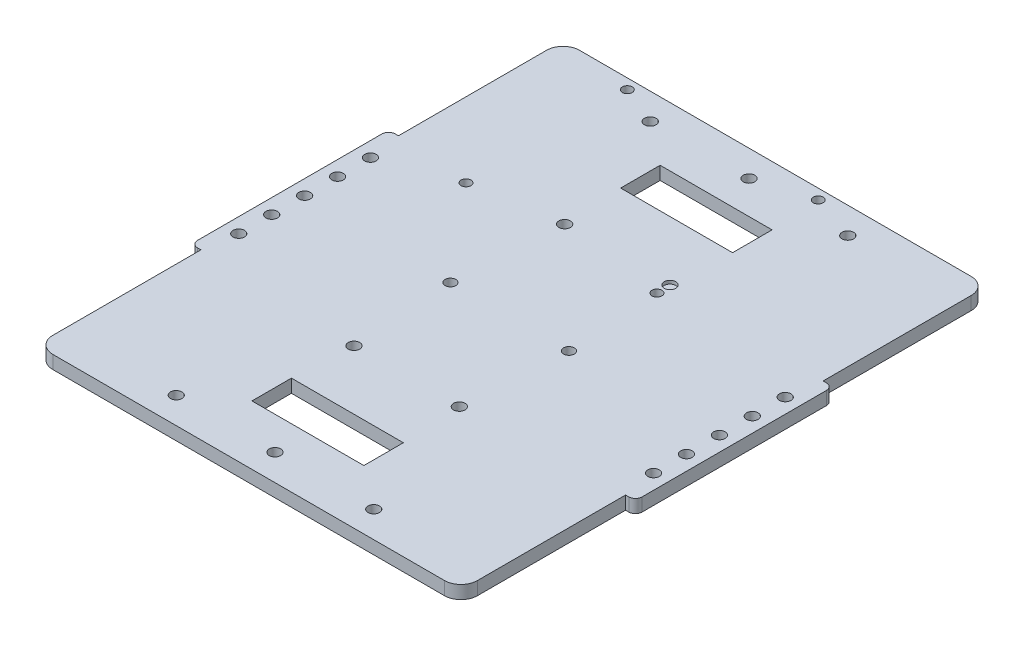
from build123d import *

# Parameters (mm, degrees)
SKETCH_1_W               = 135
SKETCH_1_H               = 100
EXTRUDE_1_DEPTH          = 4
SKETCH_2_W               = 135
SKETCH_2_H               = 4
EXTRUDE_2_DEPTH          = 60
CUT_EXTRUDE_1_DEPTH      = 130.12106722
CUT_EXTRUDE_1_DEPTH_BACK = 130.12106722
SKETCH_3_W               = 3
SKETCH_3_H               = 50
FILLET_1_R               = 5
FILLET_2_R               = 2
CUT_EXTRUDE_2_DEPTH      = 130.12106722
CUT_EXTRUDE_2_DEPTH_BACK = 130.12106722
SKETCH_4_R               = 1.75
CUT_EXTRUDE_3_DEPTH      = 130.12106722
CUT_EXTRUDE_3_DEPTH_BACK = 130.12106722
SKETCH_5_W               = 34
SKETCH_5_H               = 12
CUT_EXTRUDE_4_DEPTH      = 130.12106722
CUT_EXTRUDE_4_DEPTH_BACK = 130.12106722
SKETCH_6_R               = 1.75
CUT_EXTRUDE_5_DEPTH      = 130.12106722
CUT_EXTRUDE_5_DEPTH_BACK = 130.12106722
SKETCH_7_R               = 1.63491013
CUT_EXTRUDE_6_DEPTH      = 130.12106722
CUT_EXTRUDE_6_DEPTH_BACK = 130.12106722
SKETCH_8_R               = 1.5
SKETCH_9_R               = 1.75
EXTRUDE_3_DEPTH          = 3
CUT_EXTRUDE_7_DEPTH      = 130.12106722
CUT_EXTRUDE_7_DEPTH_BACK = 130.12106722
SKETCH_10_R              = 1.75


with BuildPart() as part:
    # 草图1 → 凸台-拉伸1 (new body)
    with BuildSketch(Plane(origin=(0, 0, 0), x_dir=(1, 0, 0), z_dir=(0, 1, 0))):
        Rectangle(SKETCH_1_W, SKETCH_1_H)
    extrude(amount=EXTRUDE_1_DEPTH)

    # 草图2 → 凸台-拉伸2 (add)
    with BuildSketch(Plane.XY.offset(50)):
        with Locations((0, 2)):
            Rectangle(SKETCH_2_W, SKETCH_2_H)
    extrude(amount=EXTRUDE_2_DEPTH)

    # 草图3 → 切除-拉伸1 (cut, two sides: drawn at the far end of the back side and taken through both)
    with BuildSketch(Plane(origin=(0, 4, 0), x_dir=(1, 0, 0), z_dir=(0, 1, 0)).offset(-CUT_EXTRUDE_1_DEPTH_BACK)):
        with Locations((-66, 25)):
            Rectangle(SKETCH_3_W, SKETCH_3_H)
        with Locations((66, 25)):
            Rectangle(SKETCH_3_W, SKETCH_3_H)
        with Locations((-66, -85)):
            Rectangle(SKETCH_3_W, SKETCH_3_H)
        with Locations((66, -85)):
            Rectangle(SKETCH_3_W, SKETCH_3_H)
    extrude(amount=CUT_EXTRUDE_1_DEPTH + CUT_EXTRUDE_1_DEPTH_BACK, mode=Mode.SUBTRACT)

    # 圆角1
    fillet_1_edges = [part.edges().sort_by_distance(p)[0] for p in [
        (64.5, 2, -50),
        (-64.5, 2, 110),
        (64.5, 2, 110),
        (-64.5, 2, -50),
    ]]
    fillet(fillet_1_edges, radius=FILLET_1_R)

    # 圆角2
    fillet_2_edges = [part.edges().sort_by_distance(p)[0] for p in [
        (67.5, 2, 0),
        (-67.5, 2, 60),
        (67.5, 2, 60),
        (-67.5, 2, 0),
    ]]
    fillet(fillet_2_edges, radius=FILLET_2_R)

    # 草图4 → 切除-拉伸2 (cut, two sides: drawn at the far end of the back side and taken through both)
    with BuildSketch(Plane(origin=(0, 4, 0), x_dir=(1, 0, 0), z_dir=(0, 1, 0)).offset(-CUT_EXTRUDE_2_DEPTH_BACK)):
        with Locations(Location((-30, -102, 0), (0, 0, 270))):
            Circle(SKETCH_4_R)
        with Locations(Location((0, -102, 0), (0, 0, 270))):
            Circle(SKETCH_4_R)
        with Locations(Location((30, -102, 0), (0, 0, 270))):
            Circle(SKETCH_4_R)
        with Locations(Location((-30, 42, 0), (0, 0, 270))):
            Circle(SKETCH_4_R)
        with Locations(Location((0, 42, 0), (0, 0, 270))):
            Circle(SKETCH_4_R)
        with Locations(Location((30, 42, 0), (0, 0, 270))):
            Circle(SKETCH_4_R)
    extrude(amount=CUT_EXTRUDE_2_DEPTH + CUT_EXTRUDE_2_DEPTH_BACK, mode=Mode.SUBTRACT)

    # 草图5 → 切除-拉伸3 (cut, two sides: drawn at the far end of the back side and taken through both)
    with BuildSketch(Plane(origin=(0, 4, 0), x_dir=(1, 0, 0), z_dir=(0, 1, 0)).offset(-CUT_EXTRUDE_3_DEPTH_BACK)):
        with Locations((0, -86)):
            Rectangle(SKETCH_5_W, SKETCH_5_H)
        with Locations((0, 26)):
            Rectangle(SKETCH_5_W, SKETCH_5_H)
    extrude(amount=CUT_EXTRUDE_3_DEPTH + CUT_EXTRUDE_3_DEPTH_BACK, mode=Mode.SUBTRACT)

    # 草图6 → 切除-拉伸4 (cut, two sides: drawn at the far end of the back side and taken through both)
    with BuildSketch(Plane.XZ.offset(-CUT_EXTRUDE_4_DEPTH_BACK)):
        with Locations(Location((-16, -2, 0), (0, 0, 270))):
            Circle(SKETCH_6_R)
        with Locations(Location((16, -2, 0), (0, 0, 270))):
            Circle(SKETCH_6_R)
        with Locations(Location((16, 62, 0), (0, 0, 270))):
            Circle(SKETCH_6_R)
        with Locations(Location((-16, 62, 0), (0, 0, 270))):
            Circle(SKETCH_6_R)
    extrude(amount=CUT_EXTRUDE_4_DEPTH + CUT_EXTRUDE_4_DEPTH_BACK, mode=Mode.SUBTRACT)

    # 草图7 → 切除-拉伸5 (cut, two sides: drawn at the far end of the back side and taken through both)
    with BuildSketch(Plane.XZ.offset(-CUT_EXTRUDE_5_DEPTH_BACK)):
        with Locations(Location((18, 30.7, 0), (0, 0, 270))):
            Circle(SKETCH_7_R)
        with Locations(Location((-18, 30.7, 0), (0, 0, 270))):
            Circle(SKETCH_7_R)
    extrude(amount=CUT_EXTRUDE_5_DEPTH + CUT_EXTRUDE_5_DEPTH_BACK, mode=Mode.SUBTRACT)

    # 草图8 → 切除-拉伸6 (cut, two sides: drawn at the far end of the back side and taken through both)
    with BuildSketch(Plane.XZ.offset(-CUT_EXTRUDE_6_DEPTH_BACK)):
        with Locations(Location((-41.861200423, 2.110999836, 0), (0, 0, 270))):
            Circle(SKETCH_8_R)
        with Locations(Location((-41.861200325, -46.885600164, 0), (0, 0, 270))):
            Circle(SKETCH_8_R)
        with Locations(Location((16.138810577, 2.110999952, 0), (0, 0, 270))):
            Circle(SKETCH_8_R)
        with Locations(Location((16.138810675, -46.885600048, 0), (0, 0, 270))):
            Circle(SKETCH_8_R)
    extrude(amount=CUT_EXTRUDE_6_DEPTH + CUT_EXTRUDE_6_DEPTH_BACK, mode=Mode.SUBTRACT)

    # 草图9 → 凸台-拉伸3 (add)
    with BuildSketch(Plane.XZ):
        with Locations(Location((16, -2, 0), (0, 0, 270))):
            Circle(SKETCH_9_R)
    extrude(amount=-EXTRUDE_3_DEPTH)

    # 草图10 → 切除-拉伸7 (cut, two sides: drawn at the far end of the back side and taken through both)
    with BuildSketch(Plane(origin=(0, 4, 0), x_dir=(1, 0, 0), z_dir=(0, 1, 0)).offset(-CUT_EXTRUDE_7_DEPTH_BACK)):
        with Locations(Location((63, -10, 0), (0, 0, 270))):
            Circle(SKETCH_10_R)
        with Locations(Location((63, -20, 0), (0, 0, 270))):
            Circle(SKETCH_10_R)
        with Locations(Location((63, -30, 0), (0, 0, 270))):
            Circle(SKETCH_10_R)
        with Locations(Location((63, -40, 0), (0, 0, 270))):
            Circle(SKETCH_10_R)
        with Locations(Location((63, -50, 0), (0, 0, 270))):
            Circle(SKETCH_10_R)
        with Locations(Location((-63, -10, 0), (0, 0, 270))):
            Circle(SKETCH_10_R)
        with Locations(Location((-63, -20, 0), (0, 0, 270))):
            Circle(SKETCH_10_R)
        with Locations(Location((-63, -30, 0), (0, 0, 270))):
            Circle(SKETCH_10_R)
        with Locations(Location((-63, -40, 0), (0, 0, 270))):
            Circle(SKETCH_10_R)
        with Locations(Location((-63, -50, 0), (0, 0, 270))):
            Circle(SKETCH_10_R)
    extrude(amount=CUT_EXTRUDE_7_DEPTH + CUT_EXTRUDE_7_DEPTH_BACK, mode=Mode.SUBTRACT)


solid = part.part
